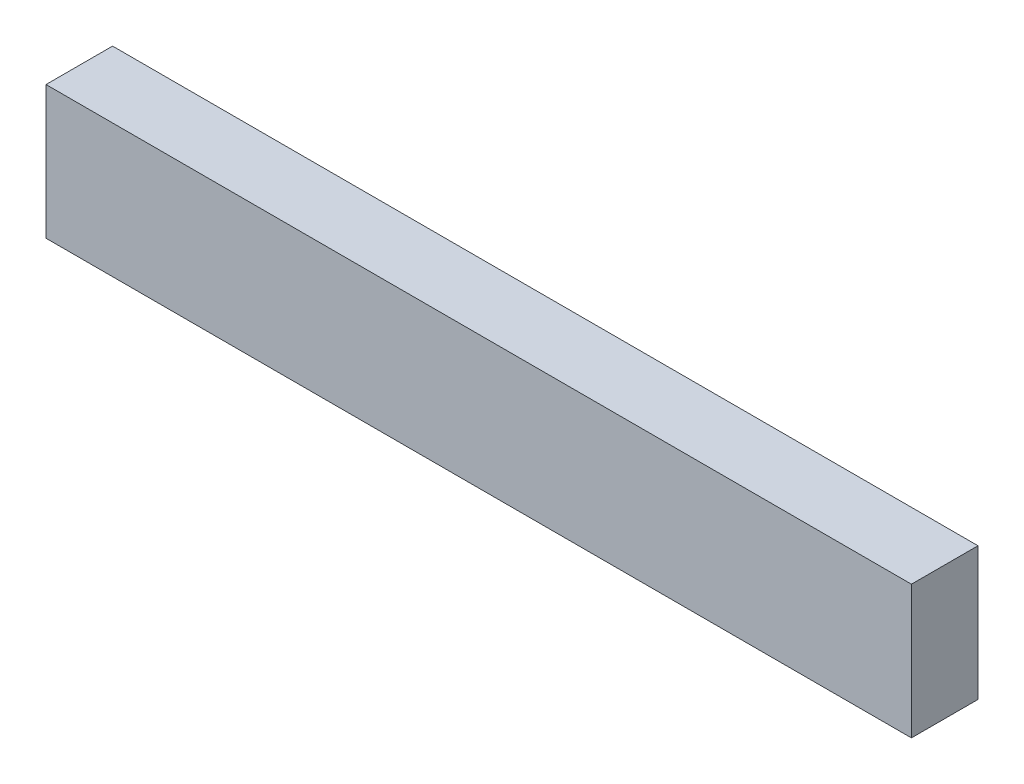
from build123d import *

# Parameters (mm, degrees)
SKETCH1_W           = 12.7
SKETCH1_H           = 25.4
BOSS_EXTRUDE1_DEPTH = 82.55


with BuildPart() as part:
    # Sketch1 → Boss-Extrude1 (new, symmetric)
    with BuildSketch(Plane(origin=(0, 0, 0), x_dir=(0, 0, -1), z_dir=(1, 0, 0))):
        Rectangle(SKETCH1_W, SKETCH1_H)
    extrude(amount=BOSS_EXTRUDE1_DEPTH, both=True)


solid = part.part
